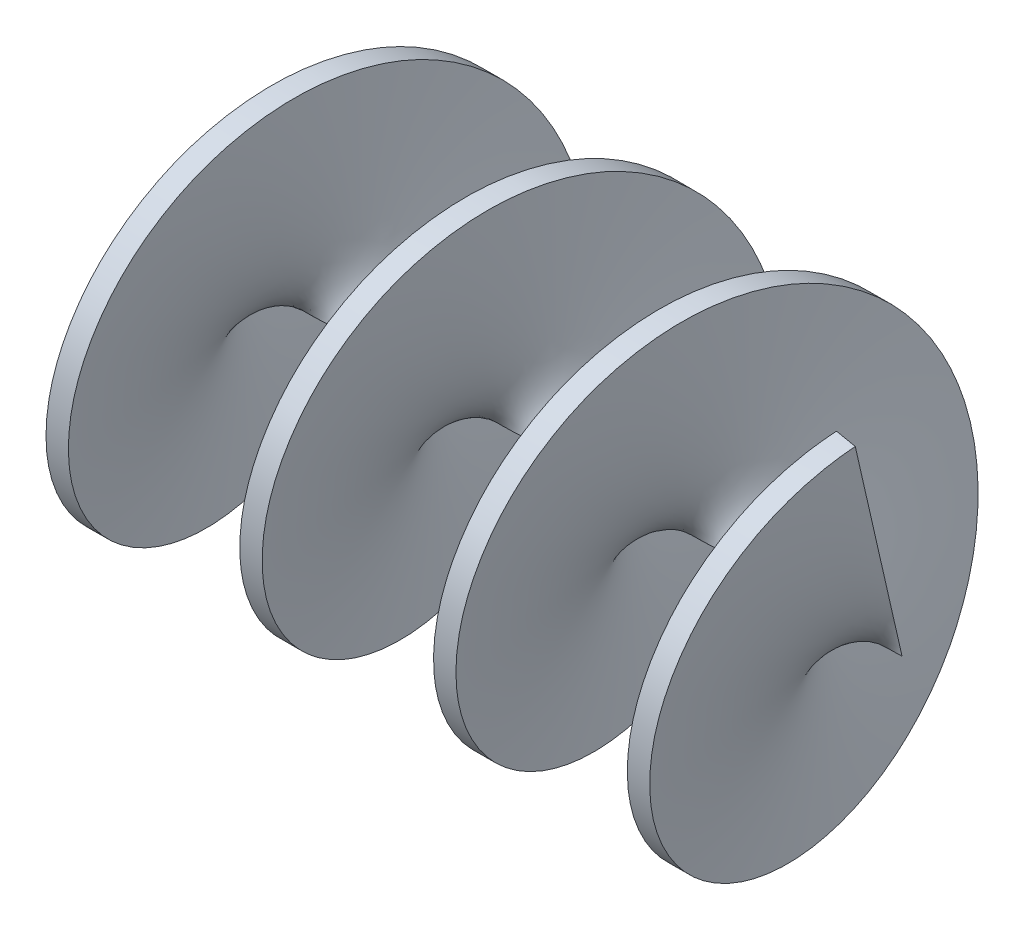
from build123d import *

# Parameters (mm, degrees)
SWEEP7_PITCH       = 7
SWEEP7_HEIGHT      = 26
SWEEP7_RADIUS      = 7.6
SWEEP7_START_ANGLE = -180
SKETCH43_W         = 0.8
SKETCH43_H         = 7.6


with BuildPart() as part:
    # Sweep7: sweep along a helix
    with BuildLine() as sweep7_path:
        add(Helix(SWEEP7_PITCH, SWEEP7_HEIGHT, SWEEP7_RADIUS, center=(0, 0, 0), direction=(1, 0, 0), lefthand=True, mode=Mode.PRIVATE).rotate(Axis((0, 0, 0), (1, 0, 0)), SWEEP7_START_ANGLE))
    # Sketch43 → Sweep7 (sweep)
    with BuildSketch(Plane(origin=(0, 0, -7.6), x_dir=(-0.9894257915170533, -0.14504000510498002, 0), z_dir=(0.14504000510498005, -0.9894257915170535, 0))):
        with Locations((0, -3.8)):
            Rectangle(SKETCH43_W, SKETCH43_H)
    sweep(path=sweep7_path.line, is_frenet=True)


solid = part.part
